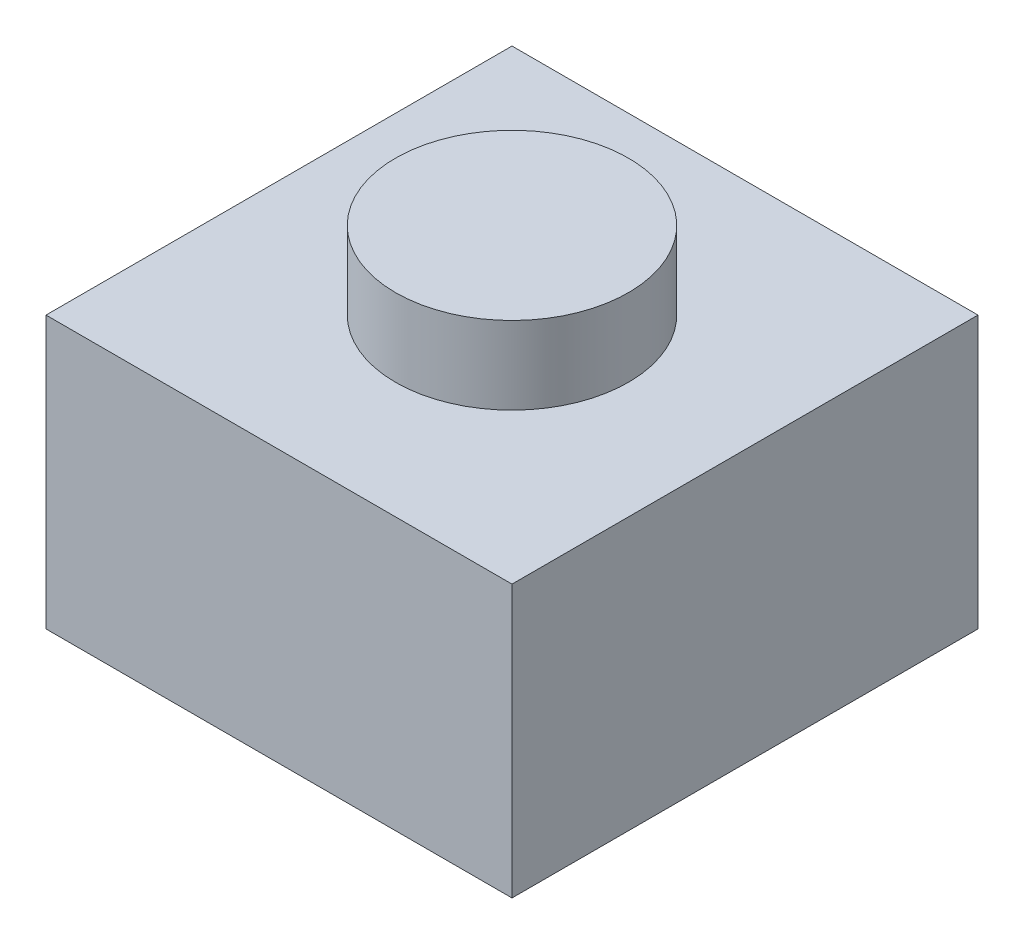
from build123d import *

# Parameters (mm, degrees)
SKETCH_1_W      = 6
SKETCH_1_H      = 6
EXTRUDE_1_DEPTH = 3.5
SKETCH_2_R      = 1.5
EXTRUDE_2_DEPTH = 1


with BuildPart() as part:
    # Эскиз1 → Бобышка-Вытянуть1 (new body)
    with BuildSketch(Plane(origin=(0, 0, 0), x_dir=(1, 0, 0), z_dir=(0, 1, 0))):
        with Locations((3, -3)):
            Rectangle(SKETCH_1_W, SKETCH_1_H)
    extrude(amount=EXTRUDE_1_DEPTH)

    # Эскиз2 → Бобышка-Вытянуть2 (add)
    with BuildSketch(Plane(origin=(0, 3.5, 0), x_dir=(1, 0, 0), z_dir=(0, 1, 0))):
        with Locations(Location((3, -3, 0), (0, 0, 270))):
            Circle(SKETCH_2_R)
    extrude(amount=EXTRUDE_2_DEPTH)


solid = part.part
